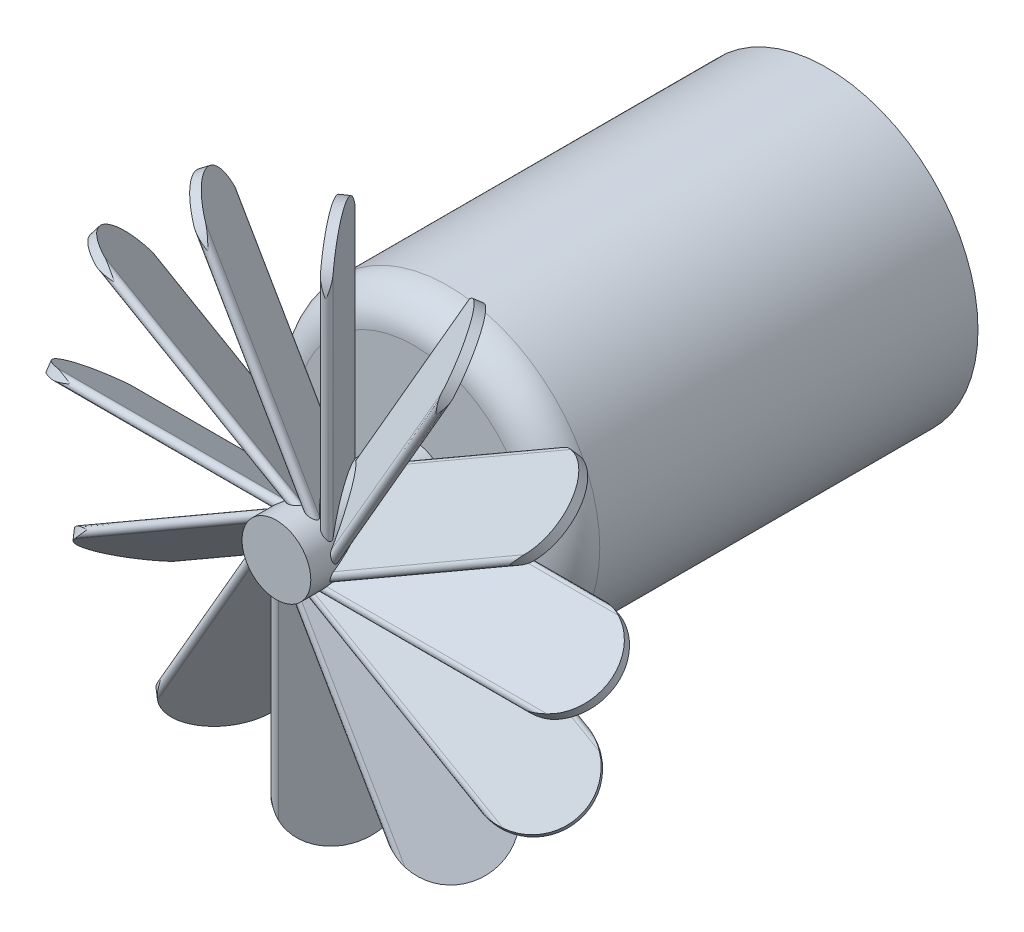
from build123d import *

# Parameters (mm, degrees)
SKETCH1_R           = 44.0463856
BOSS_EXTRUDE1_DEPTH = 120
FILLET1_R           = 10
SKETCH2_R           = 10
BOSS_EXTRUDE2_DEPTH = 40
BOSS_EXTRUDE3_DEPTH = 80
CUT_EXTRUDE1_DEPTH  = 10
CIRPATTERN1_COUNT   = 12


with BuildPart() as part:
    # Sketch1 → Boss-Extrude1 (new body)
    with BuildSketch(Plane.XY.offset(210)):
        with Locations((750, 0)):
            Circle(SKETCH1_R)
    extrude(amount=BOSS_EXTRUDE1_DEPTH)

    # Fillet1
    fillet1_edges = [part.edges().sort_by_distance(p)[0] for p in [
        (705.9536144, 0, 330),
    ]]
    fillet(fillet1_edges, radius=FILLET1_R)

    # Sketch2 → Boss-Extrude2 (add)
    with BuildSketch(Plane.XY.offset(330)):
        with Locations((750, 0)):
            Circle(SKETCH2_R)
    extrude(amount=BOSS_EXTRUDE2_DEPTH)

    # Sketch3 → Boss-Extrude3 (add)
    with BuildSketch(Plane(origin=(0, 0, 0), x_dir=(1, 0, 0), z_dir=(0, 1, 0))):
        with BuildLine():
            Line((743.852180513, -341.021069173), (758.284000863, -361.802890477))
            ThreePointArc((758.284000863, -361.802890477), (757.953443812, -363.635979579), (756.12035471, -363.305422528))
            Line((756.12035471, -363.305422528), (741.68853436, -342.523601224))
            ThreePointArc((741.68853436, -342.523601224), (742.019091411, -340.690512122), (743.852180513, -341.021069173))
        make_face()
    boss_extrude3 = extrude(amount=BOSS_EXTRUDE3_DEPTH)

    # Sketch4 → Cut-Extrude1 (cut)
    with BuildSketch(Plane(origin=(339.904788875, 0, -236.044992274), x_dir=(0.5703958094953449, 0, 0.8213699656732953), z_dir=(-0.8213699656732955, 0, 0.5703958094953449))):
        with BuildLine():
            Line((704.394630529, 80), (704.394630529, 71.964522152))
            ThreePointArc((704.394630529, 71.964522152), (709.551852075, 77.821317104), (717.04533738, 80))
            Line((717.04533738, 80), (704.394630529, 80))
        make_face()
        with BuildLine():
            Line((729.696044231, 80), (717.04533738, 80))
            ThreePointArc((717.04533738, 80), (724.538822685, 77.821317104), (729.696044231, 71.964522152))
            Line((729.696044231, 71.964522152), (729.696044231, 80))
        make_face()
        with BuildLine():
            Line((692.127883756, 86.309280482), (703.06923712, 66.02389974))
            ThreePointArc((703.06923712, 66.02389974), (703.404609288, 69.067239285), (704.394630529, 71.964522152))
            Line((704.394630529, 71.964522152), (704.394630529, 80))
            Line((704.394630529, 80), (717.04533738, 80))
            Line((717.04533738, 80), (729.696044231, 80))
            Line((729.696044231, 80), (729.696044231, 71.964522152))
            ThreePointArc((729.696044231, 71.964522152), (730.736474896, 68.831769394), (731.013140207, 65.54237855))
            Line((731.013140207, 65.54237855), (744.745146514, 86.309280482))
            Line((744.745146514, 86.309280482), (692.127883756, 86.309280482))
        make_face()
    cut_extrude1 = extrude(amount=-CUT_EXTRUDE1_DEPTH, mode=Mode.SUBTRACT)

    # CirPattern1: Boss-Extrude3, Cut-Extrude1 ×12 about axis
    cirpattern1_axis = Axis((750, 0, 0), (0, 0, 1))
    add([boss_extrude3.rotate(cirpattern1_axis, i * 360 / CIRPATTERN1_COUNT) for i in range(1, CIRPATTERN1_COUNT)])
    add([cut_extrude1.rotate(cirpattern1_axis, i * 360 / CIRPATTERN1_COUNT) for i in range(1, CIRPATTERN1_COUNT)], mode=Mode.SUBTRACT)


solid = part.part
